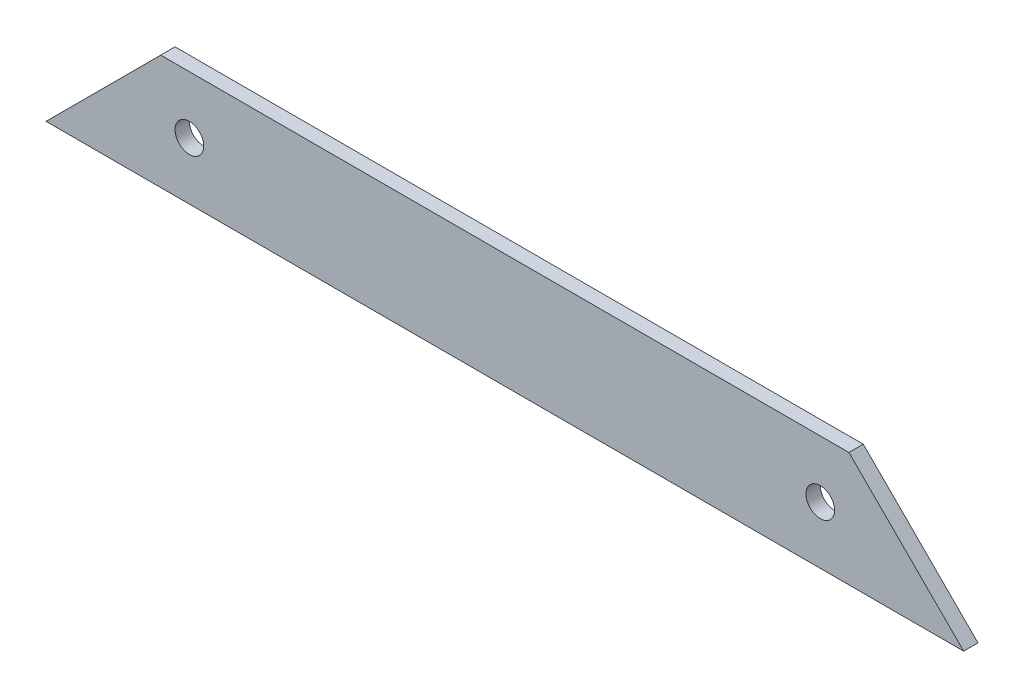
from build123d import *

# Parameters (mm, degrees)
SKETCH3_R           = 3.175
BOSS_EXTRUDE1_DEPTH = 3.175


with BuildPart() as part:
    # Sketch3 → Boss-Extrude1 (new body)
    with BuildSketch(Plane.XY):
        Polygon((76.2, 0), (-76.2, 0), (-101.6, -25.4), (101.6, -25.4), align=None)
        with Locations((-69.85, -12.7)):
            Circle(SKETCH3_R, mode=Mode.SUBTRACT)
        with Locations((69.85, -12.7)):
            Circle(SKETCH3_R, mode=Mode.SUBTRACT)
    extrude(amount=BOSS_EXTRUDE1_DEPTH)


solid = part.part
